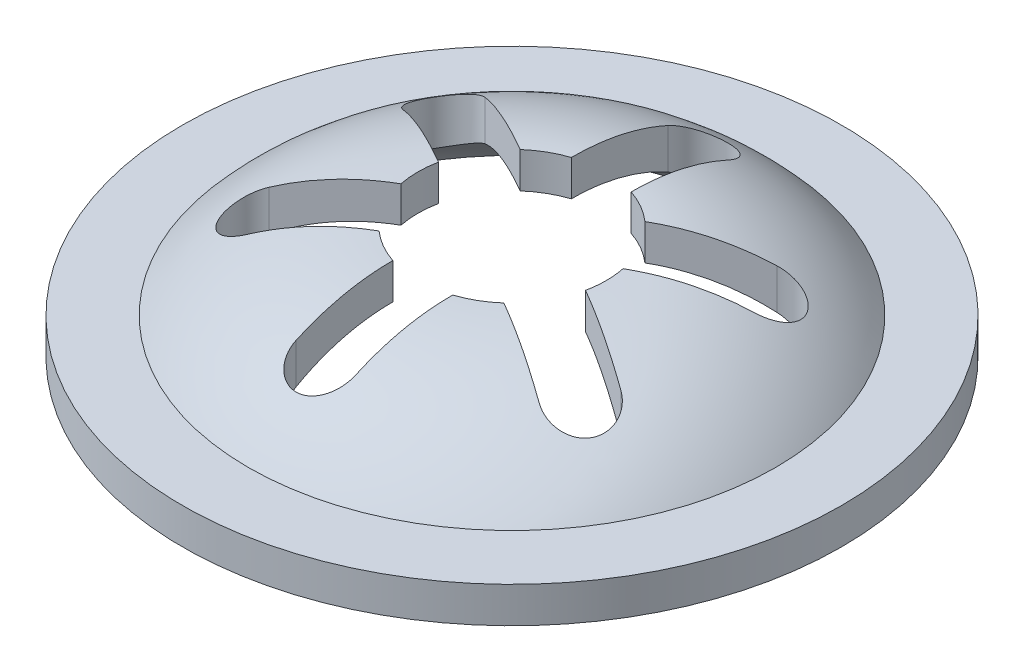
from build123d import *

# Parameters (mm, degrees)
CUT_EXTRUDE1_DEPTH = 6.093132655
CIRPATTERN1_COUNT  = 6


with BuildPart() as part:
    # Sketch2 → Revolve1 (revolve)
    with BuildSketch(Plane.XY, mode=Mode.PRIVATE) as revolve1_sk:
        with BuildLine():
            Line((-3.5, 0), (-2.617381217, 0))
            ThreePointArc((-2.617381217, 0), (-1.906460562, 0.602578494), (-1, 0.819))
            Line((-1, 0.819), (-1, 1.2))
            ThreePointArc((-1, 1.2), (-1.988782206, 0.985625726), (-2.8, 0.381))
            Line((-2.8, 0.381), (-3.5, 0.381))
            Line((-3.5, 0.381), (-3.5, 0))
        make_face()
    revolve(revolve1_sk.sketch.rotate(Axis((0, 0, 0), (0, 1, 0)), 180), axis=Axis((0, 0, 0), (0, 1, 0)))

    # Sketch3 → Cut-Extrude1 (cut, through all)
    with BuildSketch(Plane(origin=(0, 0, 0), x_dir=(1, 0, 0), z_dir=(0, 1, 0))):
        with BuildLine():
            Line((-0.3175, 1.9745), (-0.3175, 0))
            Line((-0.3175, 0), (0.3175, 0))
            Line((0.3175, 0), (0.3175, 1.9745))
            ThreePointArc((0.3175, 1.9745), (0, 2.292), (-0.3175, 1.9745))
        make_face()
    cut_extrude1 = extrude(amount=CUT_EXTRUDE1_DEPTH, mode=Mode.SUBTRACT)

    # CirPattern1: Cut-Extrude1 ×6 about axis
    cirpattern1_axis = Axis((0, 0, 0), (0, 1, 0))
    for i in range(1, CIRPATTERN1_COUNT):
        add(cut_extrude1.rotate(cirpattern1_axis, i * 360 / CIRPATTERN1_COUNT), mode=Mode.SUBTRACT)


solid = part.part
